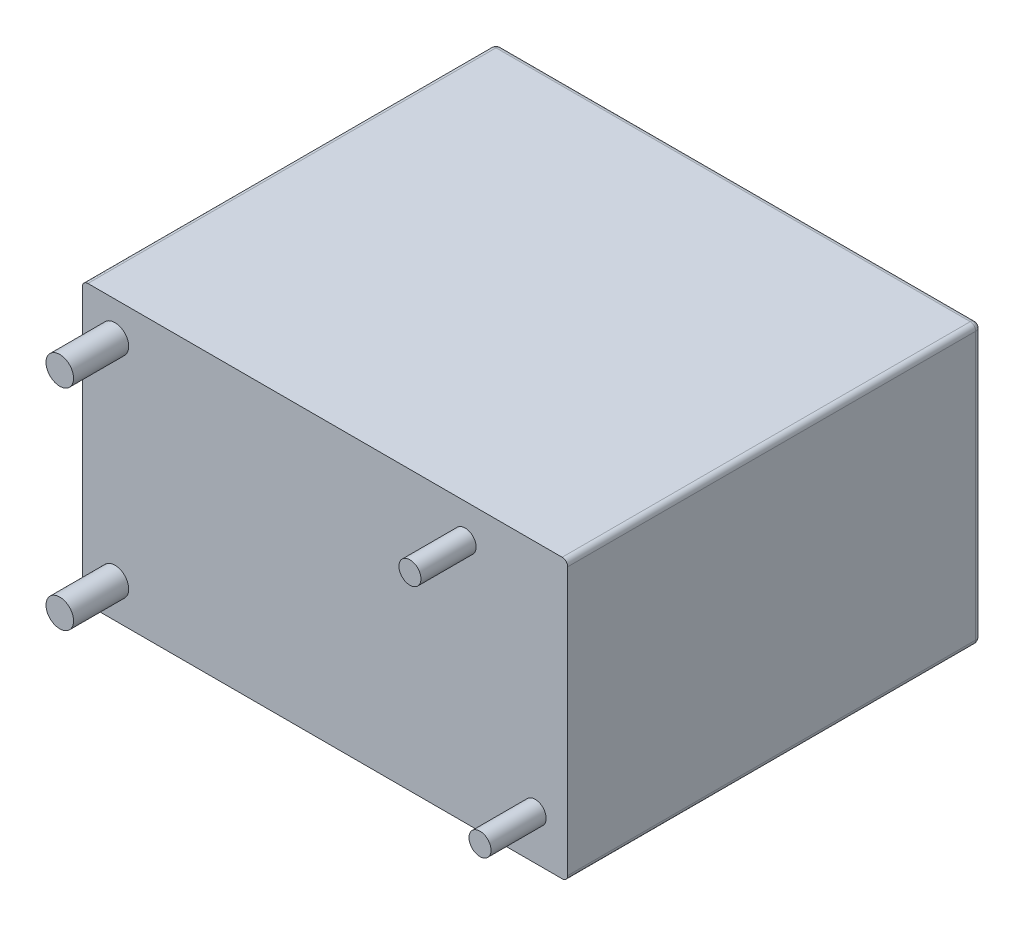
from build123d import *

# Parameters (mm, degrees)
SKETCH_1_W          = 17.6
SKETCH_1_H          = 10.1
EXTRUDE_1_DEPTH     = 15
SKETCH_2_R          = 0.5
SKETCH_2_R_2        = 0.4
EXTRUDE_2_DEPTH     = 2
FILLET_1_R          = 0.2
SKETCH_3_R          = 0.5
CUT_EXTRUDE_1_DEPTH = 0.5


with BuildPart() as part:
    # 草图1 → 凸台-拉伸1 (new body)
    with BuildSketch(Plane.XY):
        with Locations((8.8, 5.05)):
            Rectangle(SKETCH_1_W, SKETCH_1_H)
    extrude(amount=-EXTRUDE_1_DEPTH)

    # 草图2 → 凸台-拉伸2 (add)
    with BuildSketch(Plane.XY):
        with Locations(Location((1.18, 8.86, 0), (0, 0, 180))):
            Circle(SKETCH_2_R)
        with Locations(Location((13.88, 8.86, 0), (0, 0, 180))):
            Circle(SKETCH_2_R_2)
        with Locations(Location((16.42, 1.606982533, 0), (0, 0, 180))):
            Circle(SKETCH_2_R_2)
        with Locations(Location((1.18, 1.24, 0), (0, 0, 180))):
            Circle(SKETCH_2_R)
    extrude(amount=EXTRUDE_2_DEPTH)

    # 圆角1
    fillet_1_edges = [part.edges().sort_by_distance(p)[0] for p in [
        (17.6, 5.05, -15),
        (8.8, 10.1, -15),
        (0, 5.05, -15),
        (8.8, 0, -15),
        (0, 10.1, -7.5),
        (17.6, 10.1, -7.5),
        (17.6, 0, -7.5),
        (0, 0, -7.5),
    ]]
    fillet(fillet_1_edges, radius=FILLET_1_R)

    # 草图3 → 切除-拉伸1 (cut)
    with BuildSketch(Plane(origin=(0, 0, -15), x_dir=(-1, 0, 0), z_dir=(0, 0, -1))):
        with Locations((-15.910317982, 8.793351903)):
            Circle(SKETCH_3_R)
    extrude(amount=-CUT_EXTRUDE_1_DEPTH, mode=Mode.SUBTRACT)


solid = part.part
